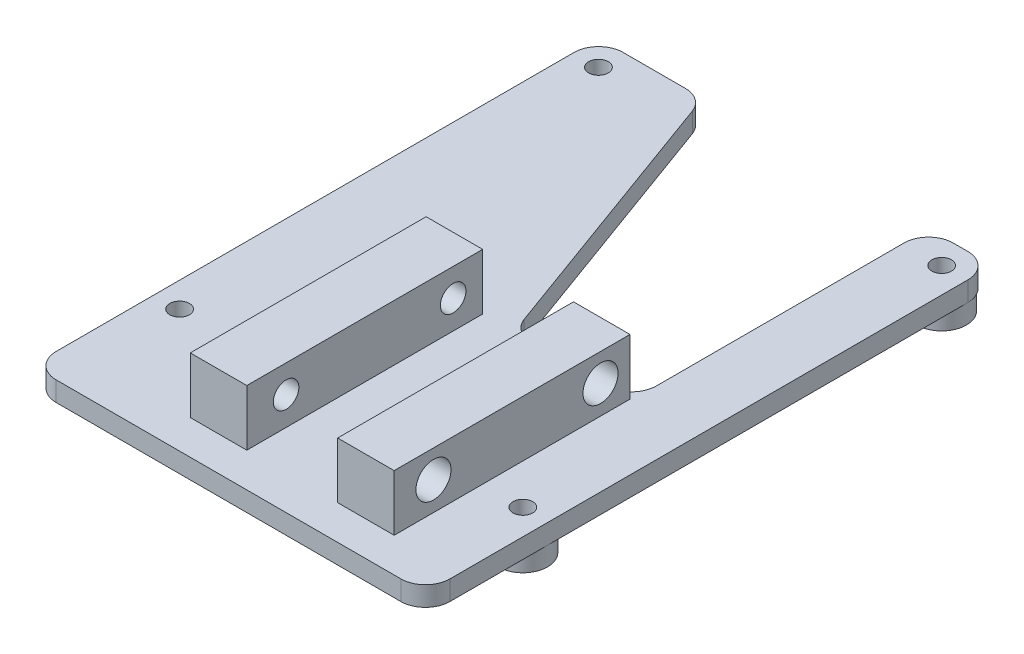
from build123d import *

# Parameters (mm, degrees)
SKETCH1_W                                = 20.746
SKETCH1_H                                = 24
BOSS_EXTRUDE1_DEPTH                      = 5.7
SKETCH9_W                                = 9.246
SKETCH9_H                                = 24
CUT_EXTRUDE3_DEPTH                       = 17.854943755
F_9_64_0_14063_DIAMETER_HOLE1_AT_2_COUNT = 2
F_9_64_0_14063_DIAMETER_HOLE1_AT_2_PITCH = 17
SKETCH8_R                                = 1.3
CUT_EXTRUDE2_DEPTH                       = 5.75
SKETCH10_W                               = 40.08
SKETCH10_H                               = 57.7
BOSS_EXTRUDE2_DEPTH                      = 2
SKETCH11_R                               = 2.515
BOSS_EXTRUDE3_DEPTH                      = 2
SKETCH12_R                               = 1
CUT_EXTRUDE4_DEPTH                       = 50.042560384
FILLET2_R                                = 2.5
CUT_EXTRUDE5_DEPTH                       = 49.410460946
FILLET3_R                                = 2.5
CUT_EXTRUDE6_DEPTH                       = 5.7


with BuildPart() as part:
    # Sketch1 → Boss-Extrude1 (new body)
    with BuildSketch(Plane(origin=(0, 0, 0), x_dir=(1, 0, 0), z_dir=(0, 1, 0))):
        Rectangle(SKETCH1_W, SKETCH1_H)
    extrude(amount=BOSS_EXTRUDE1_DEPTH)

    # Sketch9 → Cut-Extrude3 (cut, through all)
    with BuildSketch(Plane.XZ):
        Rectangle(SKETCH9_W, SKETCH9_H)
    extrude(amount=-CUT_EXTRUDE3_DEPTH, mode=Mode.SUBTRACT)


with BuildPart() as cut_extrude3_piece_1:
    # of the separate pieces the step leaves, piece 1, a body of its own (cut_extrude3_pieces)
    add(part.part.solids().sort_by_distance((-10.373, 0, -12))[0])

    # Sketch8 → Cut-Extrude2 (cut)
    with BuildSketch(Plane.ZY.offset(10.373)):
        with Locations((8, 2.9)):
            Circle(SKETCH8_R)
        with Locations((-9, 2.9)):
            Circle(SKETCH8_R)
    extrude(amount=-CUT_EXTRUDE2_DEPTH, mode=Mode.SUBTRACT)



with BuildPart() as cut_extrude3_piece_2:
    # of the separate pieces the step leaves, piece 2, a body of its own (cut_extrude3_pieces)
    add(part.part.solids().sort_by_distance((4.623, 0, -12))[0])

    # Sketch7 → 9/64 (0.14063) Diameter Hole1 (revolve, cut)
    with BuildSketch(Plane(origin=(10.373, 2.9, -9), x_dir=(0, 0, -1), z_dir=(0, 1, 0))):
        Polygon((0, 0), (0, 6.823137666), (1.786001, 5.75), (1.786001, 0), align=None)
    f_9_64_0_14063_diameter_hole1 = revolve(axis=Axis((16.723, 2.9, -9), (-1, 0, 0)), mode=Mode.SUBTRACT)

    # 9/64 (0.14063) Diameter Hole1 at 2: 9/64 (0.14063) Diameter Hole1 ×2
    with Locations(*[(0, 0, i * F_9_64_0_14063_DIAMETER_HOLE1_AT_2_PITCH) for i in range(1, F_9_64_0_14063_DIAMETER_HOLE1_AT_2_COUNT)]):
        add(f_9_64_0_14063_diameter_hole1, mode=Mode.SUBTRACT)


with BuildPart() as cut_extrude3_piece_1_1:
    add(cut_extrude3_piece_1.part)

    add(cut_extrude3_piece_2.part)  # Boss-Extrude2 merges Cut-Extrude3 piece 2
    # Sketch10 → Boss-Extrude2 (add)
    with BuildSketch(Plane.XZ):
        with Locations((-2.987, -13.35)):
            Rectangle(SKETCH10_W, SKETCH10_H)
    extrude(amount=BOSS_EXTRUDE2_DEPTH)

    # Sketch11 → Boss-Extrude3 (add)
    with BuildSketch(Plane.XZ.offset(2)):
        with Locations(Location((14.453, 2.985, 0), (0, 0, 90))):
            Circle(SKETCH11_R)
        with Locations(Location((-20.475, 2.985, 0), (0, 0, 90))):
            Circle(SKETCH11_R)
        with Locations(Location((14.45, -39.6362, 0), (0, 0, 90))):
            Circle(SKETCH11_R)
        with Locations(Location((-20.475, -39.6362, 0), (0, 0, 90))):
            Circle(SKETCH11_R)
    extrude(amount=BOSS_EXTRUDE3_DEPTH)

    # Sketch12 → Cut-Extrude4 (cut, through all)
    with BuildSketch(Plane.XZ.offset(4)):
        with Locations(Location((14.453, 2.985, 0), (0, 0, 270))):
            Circle(SKETCH12_R)
        with Locations(Location((-20.475, 2.985, 0), (0, 0, 270))):
            Circle(SKETCH12_R)
        with Locations(Location((-20.475, -39.6362, 0), (0, 0, 270))):
            Circle(SKETCH12_R)
        with Locations(Location((14.45, -39.6362, 0), (0, 0, 270))):
            Circle(SKETCH12_R)
    extrude(amount=-CUT_EXTRUDE4_DEPTH, mode=Mode.SUBTRACT)

    # Fillet2
    fillet2_edges = [cut_extrude3_piece_1_1.edges().sort_by_distance(p)[0] for p in [
        (17.053, -1, -42.2),
        (17.053, -1, 15.5),
        (-23.027, -1, 15.5),
        (-23.027, -1, -42.2),
    ]]
    fillet(fillet2_edges, radius=FILLET2_R)

    # Sketch14 → Cut-Extrude5 (cut, through all)
    with BuildSketch(Plane(origin=(0, 0, 0), x_dir=(1, 0, 0), z_dir=(0, 1, 0))):
        Polygon((10.553, 42.2), (10.553, 12), (-1.447, 12), (-12.438901075, 42.2), align=None)
    extrude(amount=-CUT_EXTRUDE5_DEPTH, mode=Mode.SUBTRACT)

    # Fillet3
    fillet3_edges = [cut_extrude3_piece_1_1.edges().sort_by_distance(p)[0] for p in [
        (10.553, -1, -12),
        (-1.447, -1, -12),
        (10.553, -1, -42.2),
        (-12.438901075, -1, -42.2),
    ]]
    fillet(fillet3_edges, radius=FILLET3_R)

    # Sketch15 → Cut-Extrude6 (cut)
    with BuildSketch(Plane(origin=(0, 5.7, 0), x_dir=(1, 0, 0), z_dir=(0, 1, 0))):
        with BuildLine():
            Line((8.053, 12), (10.373, 12))
            Line((10.373, 12), (10.373, 13.568549518))
            ThreePointArc((10.373, 13.568549518), (9.453245299, 12.428934308), (8.053, 12))
        make_face()
    extrude(amount=-CUT_EXTRUDE6_DEPTH, mode=Mode.SUBTRACT)


solid = cut_extrude3_piece_1_1.part
